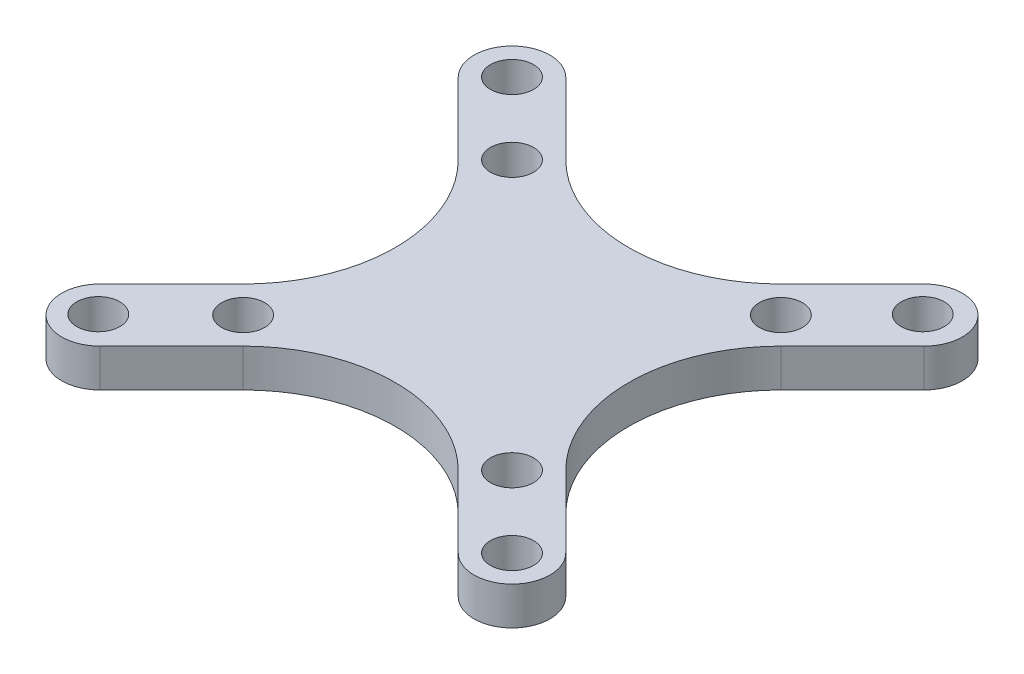
from build123d import *

# Parameters (mm, degrees)
BOSS_EXTRUDE1_DEPTH  = 3
M3_CLEARANCE_HOLE3_D = 3.4


with BuildPart() as part:
    # Sketch1 → Boss-Extrude1 (new body)
    with BuildSketch(Plane(origin=(0, 0, 0), x_dir=(1, 0, 0), z_dir=(0, 1, 0))):
        with BuildLine():
            ThreePointArc((-14.142135624, 18.384776311), (-18.384776311, 18.384776311), (-18.384776311, 14.142135624))
            Line((-18.384776311, 14.142135624), (-12.727922061, 8.485281374))
            ThreePointArc((-12.727922061, 8.485281374), (-9.213203436, 0), (-12.727922061, -8.485281374))
            Line((-12.727922061, -8.485281374), (-18.384776311, -14.142135624))
            ThreePointArc((-18.384776311, -14.142135624), (-18.384776311, -18.384776311), (-14.142135624, -18.384776311))
            Line((-14.142135624, -18.384776311), (-8.485281374, -12.727922061))
            ThreePointArc((-8.485281374, -12.727922061), (0, -9.213203436), (8.485281374, -12.727922061))
            Line((8.485281374, -12.727922061), (14.142135624, -18.384776311))
            ThreePointArc((14.142135624, -18.384776311), (18.384776311, -18.384776311), (18.384776311, -14.142135624))
            Line((18.384776311, -14.142135624), (12.727922061, -8.485281374))
            ThreePointArc((12.727922061, -8.485281374), (9.213203436, 0), (12.727922061, 8.485281374))
            Line((12.727922061, 8.485281374), (18.384776311, 14.142135624))
            ThreePointArc((18.384776311, 14.142135624), (18.384776311, 18.384776311), (14.142135624, 18.384776311))
            Line((14.142135624, 18.384776311), (8.485281374, 12.727922061))
            ThreePointArc((8.485281374, 12.727922061), (0, 9.213203436), (-8.485281374, 12.727922061))
            Line((-8.485281374, 12.727922061), (-14.142135624, 18.384776311))
        make_face()
    extrude(amount=BOSS_EXTRUDE1_DEPTH)

    # M3 Clearance Hole3 (through all)
    with Locations(Plane(origin=(0, 3, 0), x_dir=(1, 0, 0), z_dir=(0, 1, 0))):
        with Locations((-16.379512961, -16.263455967), (-10.606601718, -10.606601718), (16.263455967, -16.263455967), (10.606601718, -10.606601718), (16.147398973, 16.263455967), (10.606601718, 10.606601718), (-10.606601718, 10.606601718), (-16.263455967, 16.263455967)):
            Hole(M3_CLEARANCE_HOLE3_D / 2)


solid = part.part
